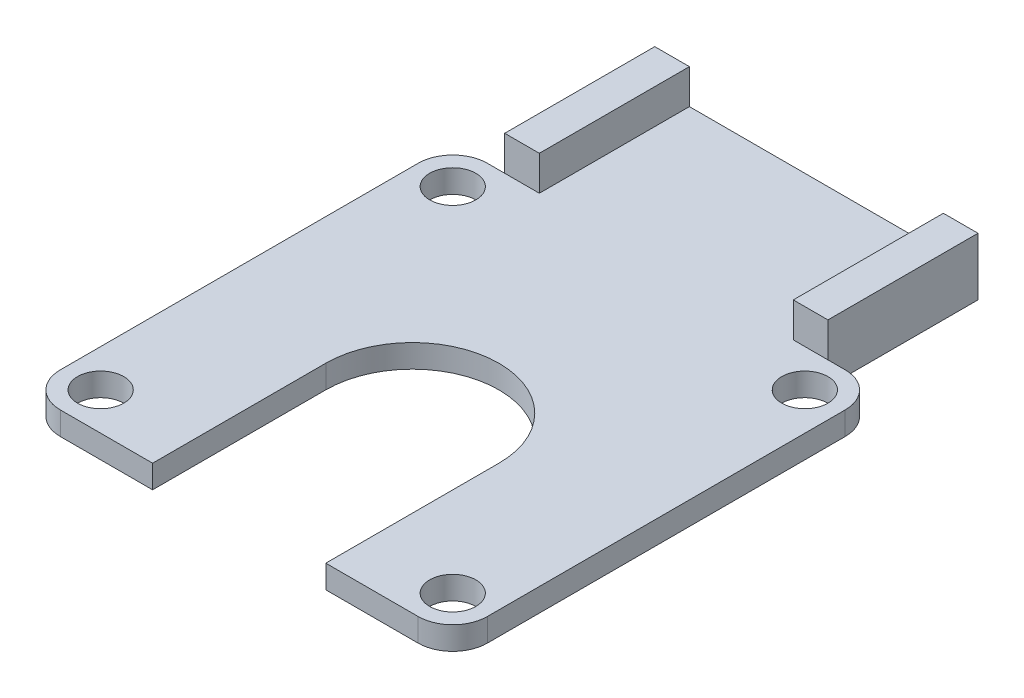
from build123d import *

# Parameters (mm, degrees)
SKETCH1_W                = 37
SKETCH1_H                = 37
BOSS_EXTRUDE1_DEPTH      = 2
FILLET1_R                = 3
F_4_0_4_DIAMETER_HOLE1_D = 4
SKETCH6_W                = 28
SKETCH6_H                = 13
BOSS_EXTRUDE3_DEPTH      = 2
SKETCH7_W                = 3
SKETCH7_H                = 13
BOSS_EXTRUDE4_DEPTH      = 3
SKETCH8_W                = 15
SKETCH8_H                = 15
CUT_EXTRUDE1_DEPTH       = 37.653785616


with BuildPart() as part:
    # Sketch1 → Boss-Extrude1 (new body)
    with BuildSketch(Plane(origin=(0, 0, 0), x_dir=(1, 0, 0), z_dir=(0, 1, 0))):
        Rectangle(SKETCH1_W, SKETCH1_H)
    extrude(amount=BOSS_EXTRUDE1_DEPTH)

    # Fillet1
    fillet1_edges = [part.edges().sort_by_distance(p)[0] for p in [
        (-18.5, 1, -18.5),
        (18.5, 1, -18.5),
        (18.5, 1, 18.5),
        (-18.5, 1, 18.5),
    ]]
    fillet(fillet1_edges, radius=FILLET1_R)

    # Ø4.0 (4) Diameter Hole1 (through all)
    with Locations(Plane(origin=(0, 2, 0), x_dir=(1, 0, 0), z_dir=(0, 1, 0))):
        with Locations((-15.25, 15.25), (15.25, -15.25), (15.25, 15.25), (-15.25, -15.25)):
            Hole(F_4_0_4_DIAMETER_HOLE1_D / 2)

    # Sketch6 → Boss-Extrude3 (add, through all)
    with BuildSketch(Plane(origin=(0, 2, 0), x_dir=(1, 0, 0), z_dir=(0, 1, 0))):
        with Locations((0, 25)):
            Rectangle(SKETCH6_W, SKETCH6_H)
    extrude(amount=-BOSS_EXTRUDE3_DEPTH)

    # Sketch7 → Boss-Extrude4 (add)
    with BuildSketch(Plane(origin=(0, 2, 0), x_dir=(1, 0, 0), z_dir=(0, 1, 0))):
        with Locations((-12.5, 25)):
            Rectangle(SKETCH7_W, SKETCH7_H)
        with Locations((12.5, 25)):
            Rectangle(SKETCH7_W, SKETCH7_H)
    extrude(amount=BOSS_EXTRUDE4_DEPTH)

    # Sketch8 → Cut-Extrude1 (cut, through all)
    with BuildSketch(Plane(origin=(0, 2, 0), x_dir=(1, 0, 0), z_dir=(0, 1, 0))):
        with BuildLine():
            Line((7.5, -3.5), (-7.5, -3.5))
            ThreePointArc((-7.5, -3.5), (0, 4), (7.5, -3.5))
        make_face()
        with Locations((0, -11)):
            Rectangle(SKETCH8_W, SKETCH8_H)
    extrude(amount=-CUT_EXTRUDE1_DEPTH, mode=Mode.SUBTRACT)


solid = part.part
